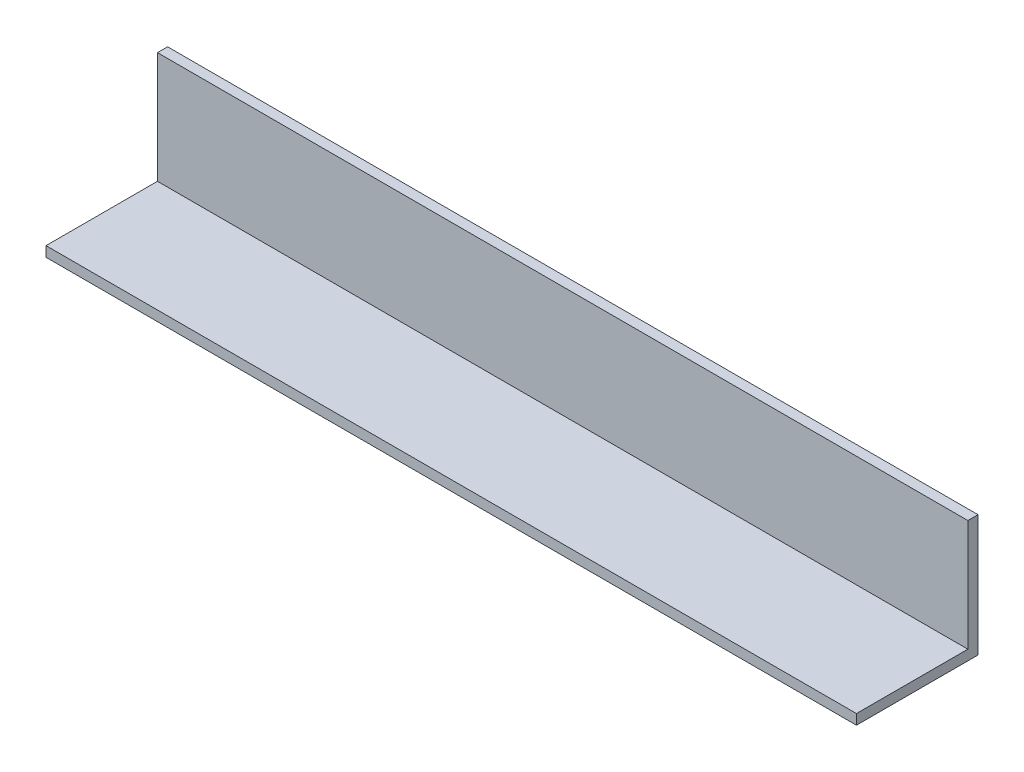
from build123d import *

# Parameters (mm, degrees)
SKETCH2_W           = 19.05
SKETCH2_H           = 19.05
BOSS_EXTRUDE1_DEPTH = 127
SKETCH4_W           = 17.4625
SKETCH4_H           = 17.4625
CUT_EXTRUDE1_DEPTH  = 127


with BuildPart() as part:
    # Sketch2 → Boss-Extrude1 (new body)
    with BuildSketch(Plane(origin=(0, 0, 0), x_dir=(0, 0, -1), z_dir=(1, 0, 0))):
        with Locations((9.525, 9.525)):
            Rectangle(SKETCH2_W, SKETCH2_H)
    extrude(amount=BOSS_EXTRUDE1_DEPTH)

    # Sketch4 → Cut-Extrude1 (cut)
    with BuildSketch(Plane.ZY):
        with Locations((-8.73125, 10.31875)):
            Rectangle(SKETCH4_W, SKETCH4_H)
    extrude(amount=-CUT_EXTRUDE1_DEPTH, mode=Mode.SUBTRACT)


solid = part.part
